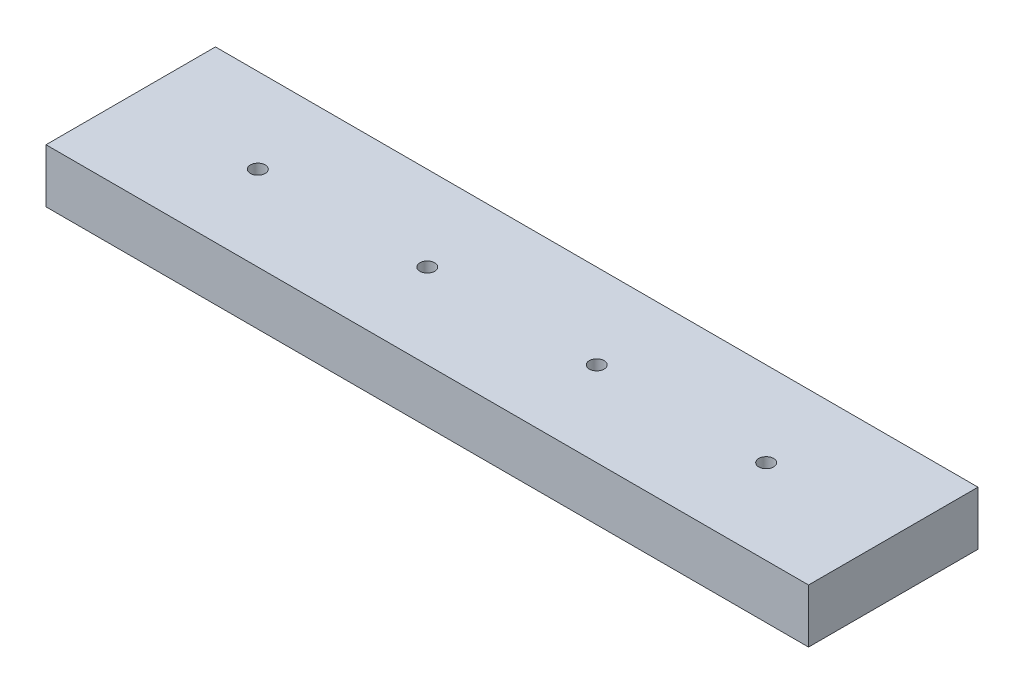
from build123d import *

# Parameters (mm, degrees)
SKETCH1_W                      = 90
SKETCH1_H                      = 20
BOSS_EXTRUDE1_DEPTH            = 6.35
TAP_DRILL_FOR_M2_2X0_45_TAP1_D = 1.75


with BuildPart() as part:
    # Sketch1 → Boss-Extrude1 (new body)
    with BuildSketch(Plane(origin=(0, 0, 0), x_dir=(1, 0, 0), z_dir=(0, 1, 0))):
        Rectangle(SKETCH1_W, SKETCH1_H)
    extrude(amount=BOSS_EXTRUDE1_DEPTH)

    # Tap Drill for M2.2x0.45 Tap1 (through all)
    with Locations(Plane(origin=(0, 6.35, 0), x_dir=(1, 0, 0), z_dir=(0, 1, 0))):
        with Locations((-30, 0), (-10, 0), (30, 0), (10, 0)):
            Hole(TAP_DRILL_FOR_M2_2X0_45_TAP1_D / 2)


solid = part.part
